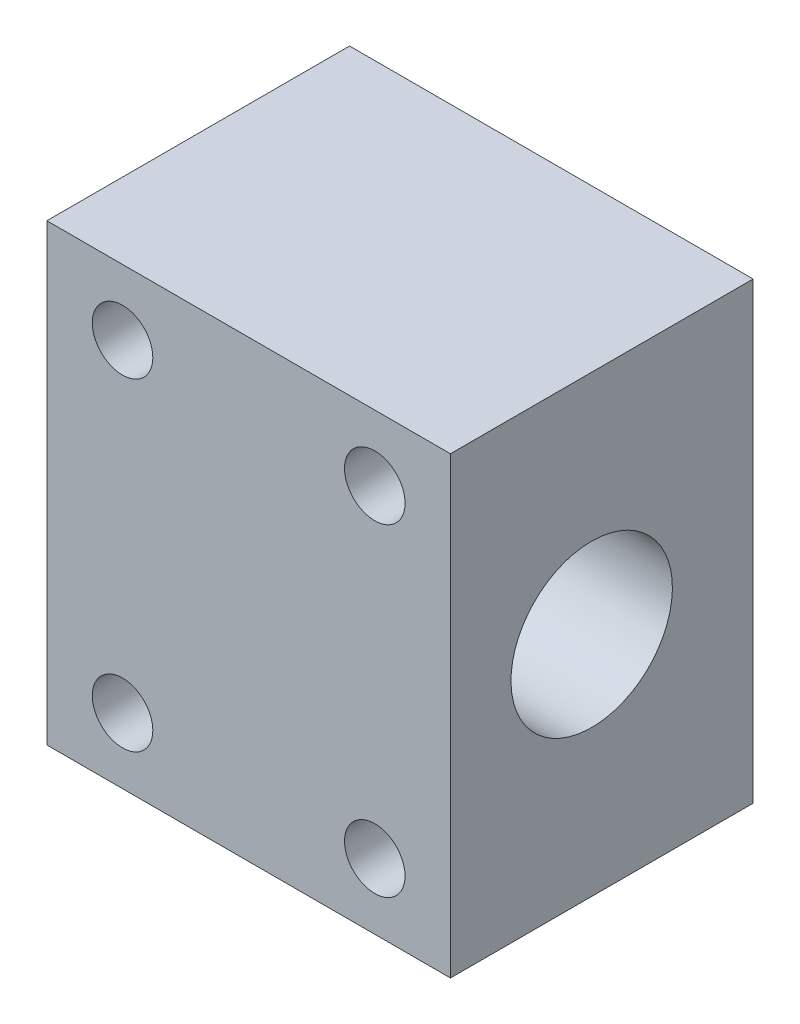
from build123d import *

# Parameters (mm, degrees)
SKETCH1_W           = 40
SKETCH1_H           = 45
BOSS_EXTRUDE1_DEPTH = 30
SKETCH2_R           = 8
CUT_EXTRUDE1_DEPTH  = 55.829280499
SKETCH3_R           = 3
CUT_EXTRUDE2_DEPTH  = 43.5


with BuildPart() as part:
    # Sketch1 → Boss-Extrude1 (new body)
    with BuildSketch(Plane.XY):
        Rectangle(SKETCH1_W, SKETCH1_H)
    extrude(amount=BOSS_EXTRUDE1_DEPTH)

    # Sketch2 → Cut-Extrude1 (cut, through all)
    with BuildSketch(Plane(origin=(20, 0, 0), x_dir=(0, 0, -1), z_dir=(1, 0, 0))):
        with Locations(Location((-16, 0, 0), (0, 0, 90))):
            Circle(SKETCH2_R)
    extrude(amount=-CUT_EXTRUDE1_DEPTH, mode=Mode.SUBTRACT)

    # Sketch3 → Cut-Extrude2 (cut, through all)
    with BuildSketch(Plane.XY.offset(30)):
        with Locations((-12.5, 16)):
            Circle(SKETCH3_R)
        with Locations((12.5, 16)):
            Circle(SKETCH3_R)
        with Locations((12.5, -16)):
            Circle(SKETCH3_R)
        with Locations((-12.5, -16)):
            Circle(SKETCH3_R)
    extrude(amount=-CUT_EXTRUDE2_DEPTH, mode=Mode.SUBTRACT)


solid = part.part
